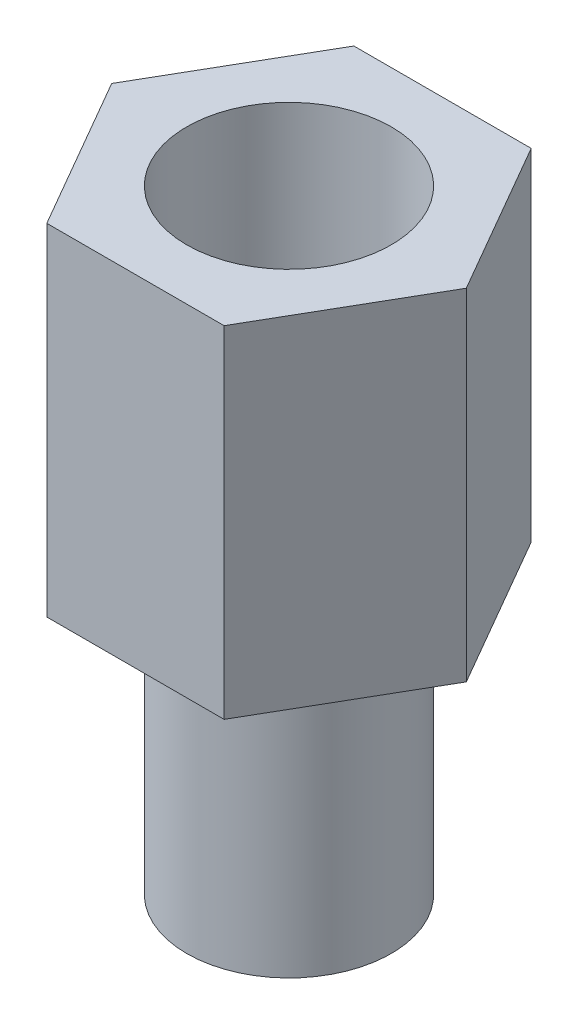
from build123d import *

# Parameters (mm, degrees)
EXTRUDE_1_DEPTH     = 5
SKETCH_2_R          = 1.5
CUT_EXTRUDE_1_DEPTH = 3.5
SKETCH_3_R          = 1.5
EXTRUDE_2_DEPTH     = 4


with BuildPart() as part:
    # 草图1 → 凸台-拉伸1 (new body)
    with BuildSketch(Plane(origin=(0, 0, 0), x_dir=(1, 0, 0), z_dir=(0, 1, 0))):
        Polygon((2.6, 0), (1.3, 2.25166605), (-1.3, 2.25166605), (-2.6, 0), (-1.3, -2.25166605), (1.3, -2.25166605), align=None)
    extrude(amount=EXTRUDE_1_DEPTH)

    # 草图2 → 切除-拉伸1 (cut)
    with BuildSketch(Plane(origin=(0, 5, 0), x_dir=(1, 0, 0), z_dir=(0, 1, 0))):
        with Locations(Location((0, 0, 0), (0, 0, 270))):
            Circle(SKETCH_2_R)
    extrude(amount=-CUT_EXTRUDE_1_DEPTH, mode=Mode.SUBTRACT)

    # 草图3 → 凸台-拉伸2 (add)
    with BuildSketch(Plane.XZ):
        with Locations(Location((0, 0, 0), (0, 0, 90))):
            Circle(SKETCH_3_R)
    extrude(amount=EXTRUDE_2_DEPTH)


solid = part.part
